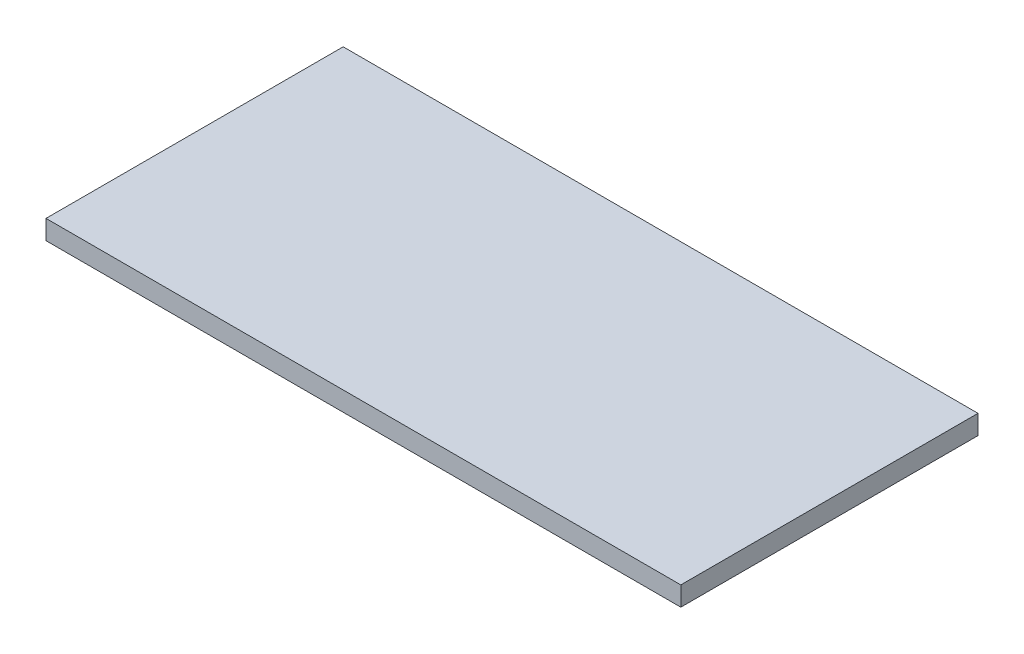
from build123d import *

# Parameters (mm, degrees)
SKETCH1_W           = 328.436343282
SKETCH1_H           = 153.756035564
BOSS_EXTRUDE1_DEPTH = 10


with BuildPart() as part:
    # Sketch1 → Boss-Extrude1 (new body)
    with BuildSketch(Plane(origin=(0, 0, 0), x_dir=(1, 0, 0), z_dir=(0, 1, 0))):
        Rectangle(SKETCH1_W, SKETCH1_H)
    extrude(amount=BOSS_EXTRUDE1_DEPTH)


solid = part.part
